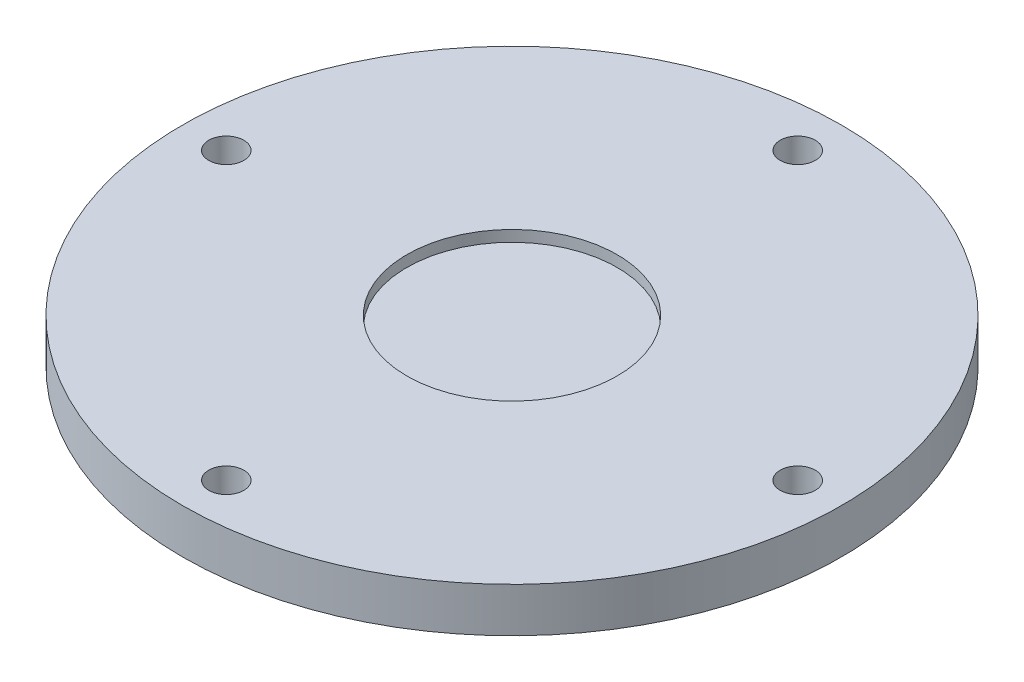
from build123d import *

# Parameters (mm, degrees)
SKETCH1_R           = 47
SKETCH1_R_2         = 2.5
BOSS_EXTRUDE1_DEPTH = 6.35
SKETCH2_R           = 15
CUT_EXTRUDE1_DEPTH  = 1.5875


with BuildPart() as part:
    # Sketch1 → Boss-Extrude1 (new body)
    with BuildSketch(Plane(origin=(0, 0, 0), x_dir=(1, 0, 0), z_dir=(0, 1, 0))):
        with Locations(Location((0, 0, 0), (0, 0, 270))):
            Circle(SKETCH1_R)
        with Locations(Location((0, 40.75, 0), (0, 0, 270))):
            Circle(SKETCH1_R_2, mode=Mode.SUBTRACT)
        with Locations(Location((40.75, 0, 0), (0, 0, 270))):
            Circle(SKETCH1_R_2, mode=Mode.SUBTRACT)
        with Locations(Location((0, -40.75, 0), (0, 0, 270))):
            Circle(SKETCH1_R_2, mode=Mode.SUBTRACT)
        with Locations(Location((-40.75, 0, 0), (0, 0, 270))):
            Circle(SKETCH1_R_2, mode=Mode.SUBTRACT)
    extrude(amount=BOSS_EXTRUDE1_DEPTH)

    # Sketch2 → Cut-Extrude1 (cut)
    with BuildSketch(Plane(origin=(0, 6.35, 0), x_dir=(1, 0, 0), z_dir=(0, 1, 0))):
        with Locations(Location((0, 0, 0), (0, 0, 270))):
            Circle(SKETCH2_R)
    extrude(amount=-CUT_EXTRUDE1_DEPTH, mode=Mode.SUBTRACT)


solid = part.part
